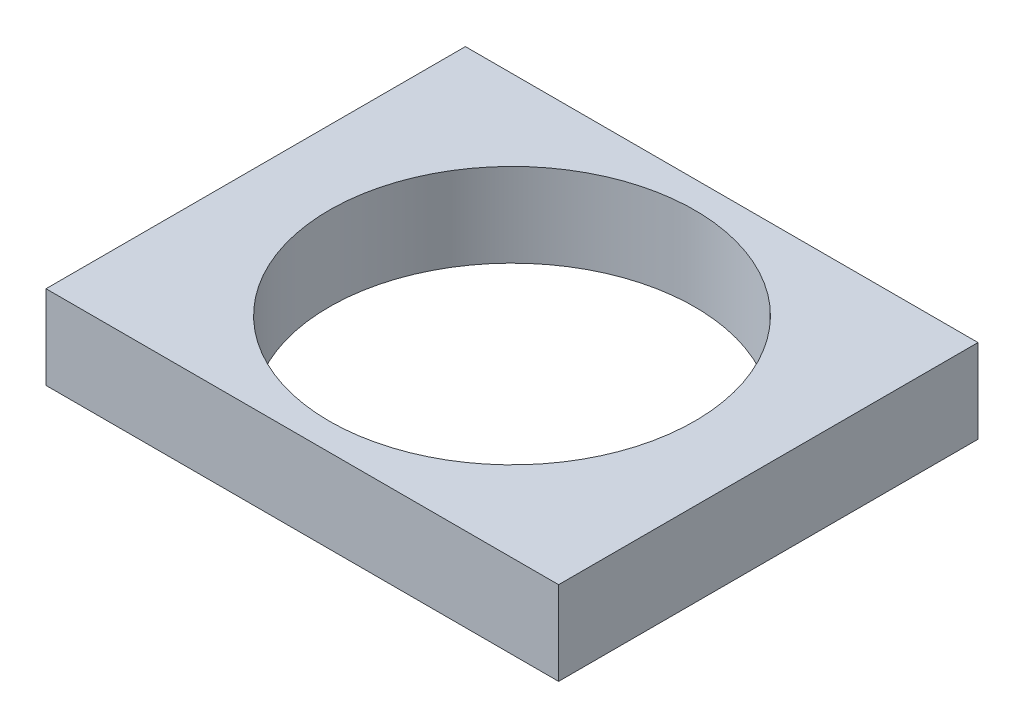
from build123d import *

# Parameters (mm, degrees)
SKETCH1_W           = 61.185553074
SKETCH1_H           = 50.06090706
SKETCH1_R           = 21.814025344
BOSS_EXTRUDE1_DEPTH = 10


with BuildPart() as part:
    # Sketch1 → Boss-Extrude1 (new body)
    with BuildSketch(Plane(origin=(0, 0, 0), x_dir=(1, 0, 0), z_dir=(0, 1, 0))):
        with Locations((-20.461402489, -7.052230955)):
            Rectangle(SKETCH1_W, SKETCH1_H)
        with Locations(Location((-20.461402489, -7.052230955, 0), (0, 0, 270))):
            Circle(SKETCH1_R, mode=Mode.SUBTRACT)
    extrude(amount=BOSS_EXTRUDE1_DEPTH)


solid = part.part
